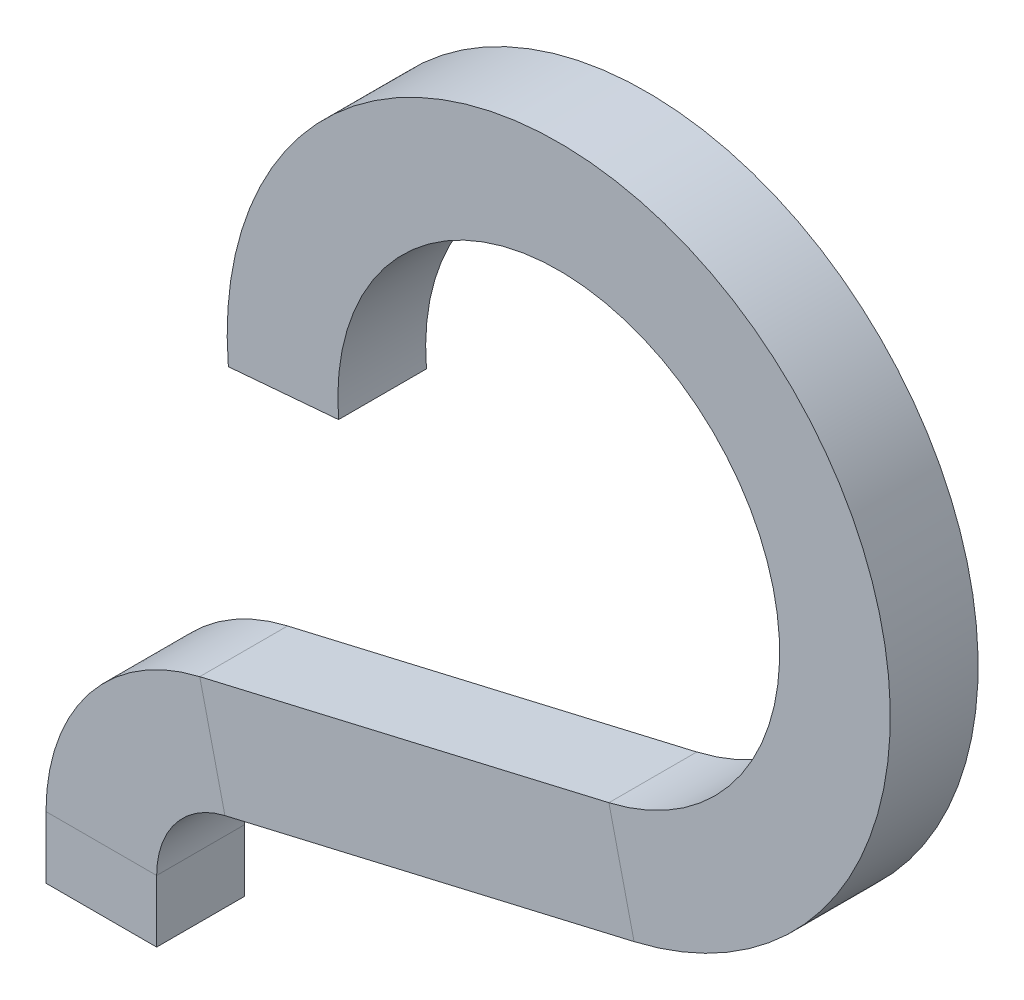
from build123d import *

# Parameters (mm, degrees)
SKETCH3_W = 36.614827086
SKETCH3_H = 29.065378202


with BuildPart() as part:
    # Sweep2: sweep along a path in Sketch2
    with BuildLine(Plane.XY) as sweep2_path:
        Line((0, 0), (0, 20.538843169))
        ThreePointArc((0, 20.538843169), (11.13741863, 52.488187839), (39.72261147, 70.590382981))
        Line((39.72261147, 70.590382981), (175.125927182, 102.165912388))
        ThreePointArc((175.125927182, 102.165912388), (206.739936817, 258.25180841), (67.990529181, 180.079854215))
    # Sketch3 → Sweep2 (sweep)
    with BuildSketch(Plane(origin=(67.990529181, 180.079854215, 0), x_dir=(-0.9964627342854863, -0.08403582081643779, 0), z_dir=(0.08403582081643779, -0.9964627342854864, 0))):
        with Locations((3.861569828, -0.377472444)):
            Rectangle(SKETCH3_W, SKETCH3_H)
    sweep(path=sweep2_path.line)


solid = part.part
